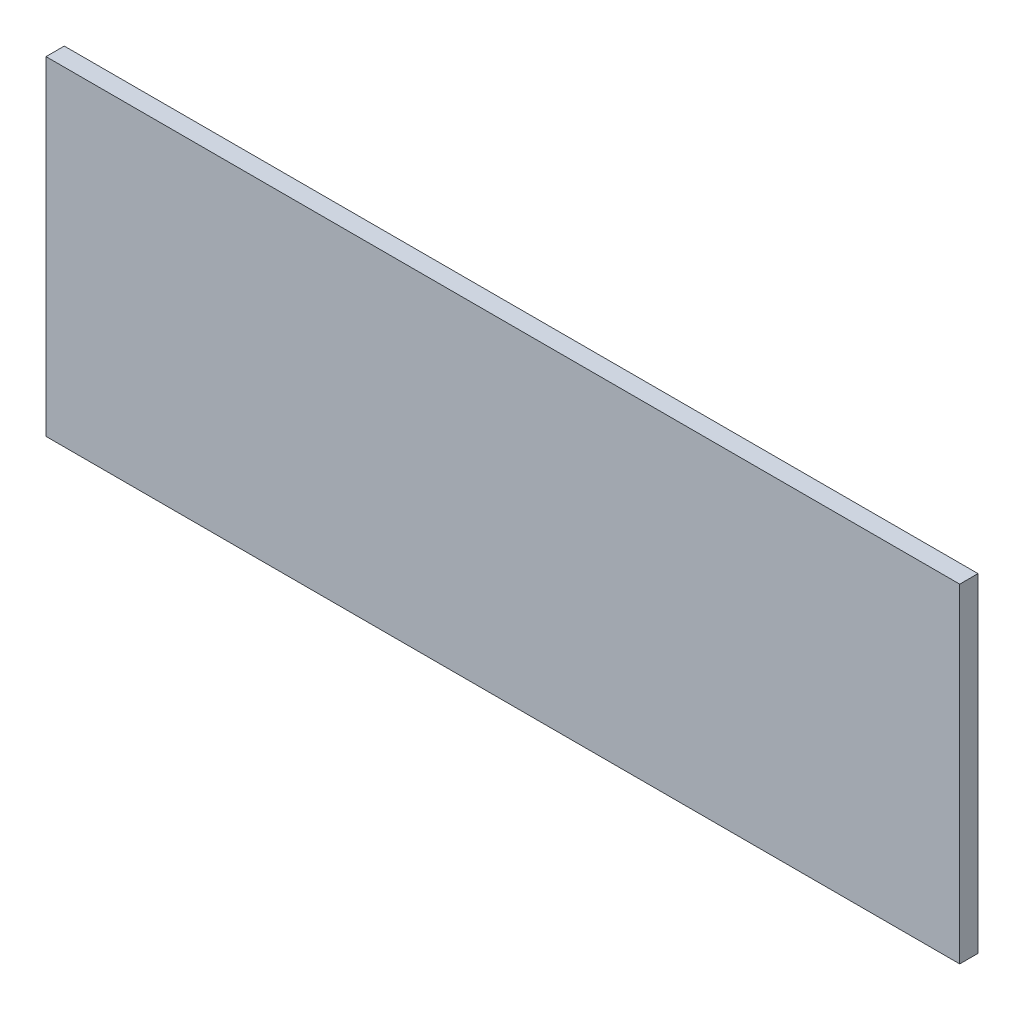
from build123d import *

# Parameters (mm, degrees)
SKETCH1_W           = 250
SKETCH1_H           = 90
BOSS_EXTRUDE1_DEPTH = 5


with BuildPart() as part:
    # Sketch1 → Boss-Extrude1 (new body)
    with BuildSketch(Plane.XY):
        Rectangle(SKETCH1_W, SKETCH1_H)
    extrude(amount=BOSS_EXTRUDE1_DEPTH)


solid = part.part
